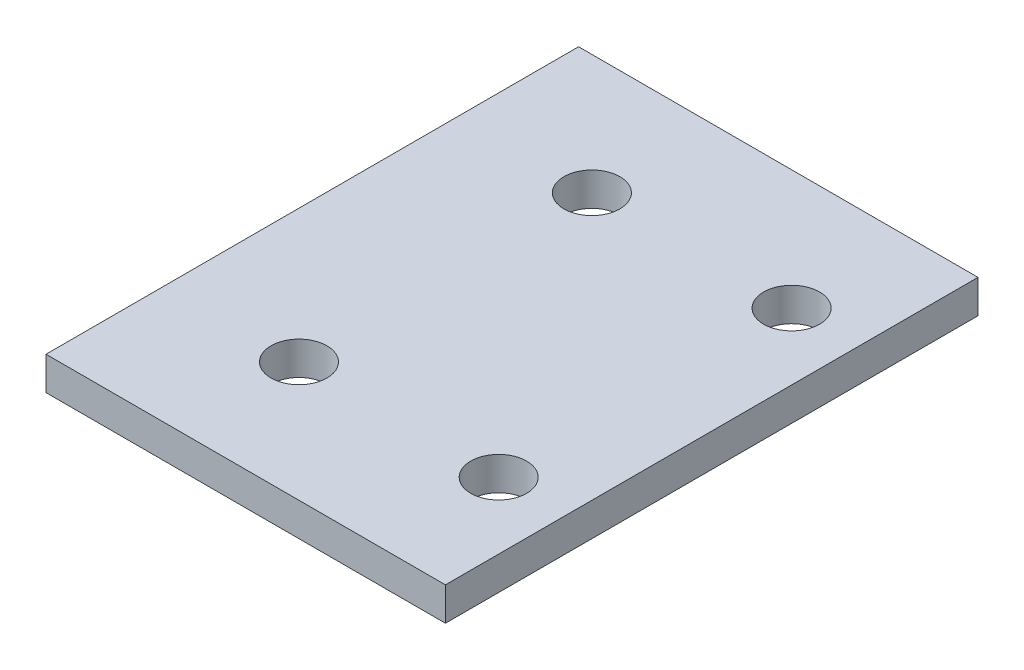
from build123d import *

# Parameters (mm, degrees)
SKETCH1_W           = 30
SKETCH1_H           = 40
SKETCH1_R           = 2.1
BOSS_EXTRUDE1_DEPTH = 2.5


with BuildPart() as part:
    # Sketch1 → Boss-Extrude1 (new body)
    with BuildSketch(Plane(origin=(0, 0, 0), x_dir=(1, 0, 0), z_dir=(0, 1, 0))):
        Rectangle(SKETCH1_W, SKETCH1_H)
        with Locations(Location((10, 11, 0), (0, 0, 270))):
            Circle(SKETCH1_R, mode=Mode.SUBTRACT)
        with Locations(Location((-5, 11, 0), (0, 0, 90))):
            Circle(SKETCH1_R, mode=Mode.SUBTRACT)
        with Locations(Location((10, -11, 0), (0, 0, 90))):
            Circle(SKETCH1_R, mode=Mode.SUBTRACT)
        with Locations(Location((-5, -11, 0), (0, 0, 270))):
            Circle(SKETCH1_R, mode=Mode.SUBTRACT)
    extrude(amount=BOSS_EXTRUDE1_DEPTH)


solid = part.part
